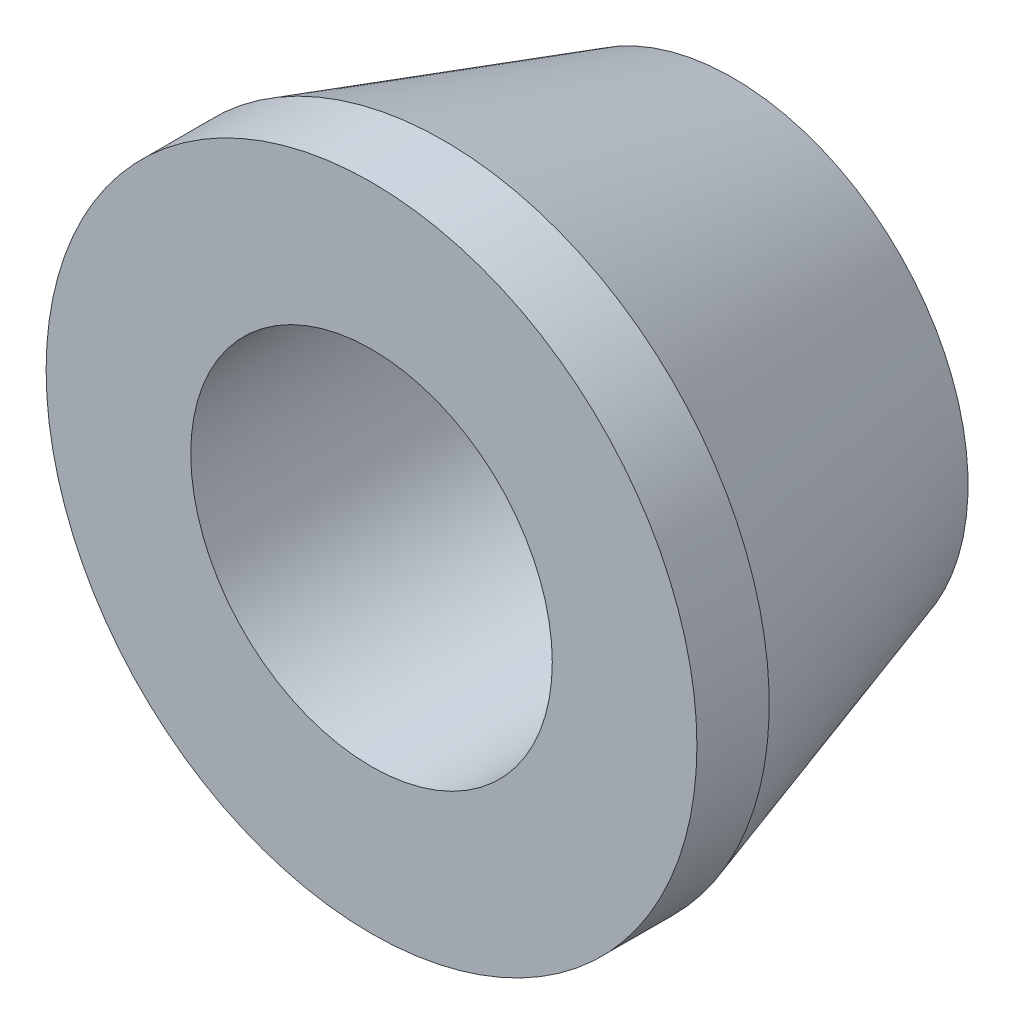
from build123d import *
from build123d.topology import SkipClean

# Parameters (mm, degrees)
SKETCH1_R           = 9
SKETCH1_R_2         = 5
BOSS_EXTRUDE1_DEPTH = 2
SKETCH3_R           = 9
SKETCH2_R           = 6.5
SKETCH4_R           = 5
CUT_EXTRUDE1_DEPTH  = 10


with BuildPart() as part:
    # Sketch1 → Boss-Extrude1 (new body)
    with BuildSketch(Plane.XY):
        Circle(SKETCH1_R)
        Circle(SKETCH1_R_2, mode=Mode.SUBTRACT)
    extrude(amount=BOSS_EXTRUDE1_DEPTH)

    # Sketch3 → Loft1 section 0
    with BuildSketch(Plane(origin=(0, 0, 0), x_dir=(-1, 0, 0), z_dir=(0, 0, -1))):
        Circle(SKETCH3_R)
    # Sketch2 → Loft1 section 1
    with BuildSketch(Plane(origin=(0, 0, -8), x_dir=(-1, 0, 0), z_dir=(0, 0, -1))):
        Circle(SKETCH2_R)
    loft()

    # Sketch4 → Cut-Extrude1 (cut)
    with SkipClean():  # the faces are left unmerged after this step: merging them gives an invalid solid
        with BuildSketch(Plane(origin=(0, 0, -8), x_dir=(-1, 0, 0), z_dir=(0, 0, -1))):
            Circle(SKETCH4_R)
        extrude(amount=-CUT_EXTRUDE1_DEPTH, mode=Mode.SUBTRACT)


solid = part.part
